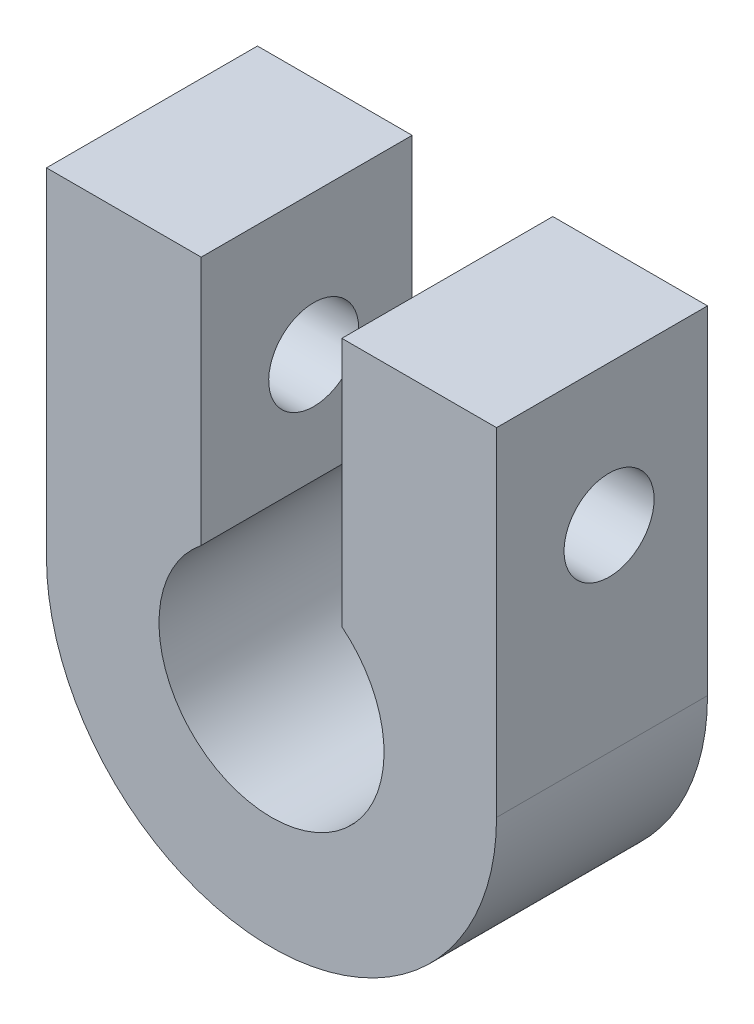
from build123d import *

# Parameters (mm, degrees)
BOSS_EXTRUDE1_DEPTH = 8
CUT_EXTRUDE1_DEPTH  = 17.492422502
CUT_EXTRUDE2_DEPTH  = 1.99
CUT_EXTRUDE4_REACH  = 23.541
SKETCH6_W           = 4
SKETCH6_H           = 8
SKETCH7_R           = 1.6
CUT_EXTRUDE5_DEPTH  = 22.540659229
CHAMFER1_SIZE       = 0.5


with BuildPart() as part:
    # Sketch1 → Boss-Extrude1 (new body)
    with BuildSketch(Plane.XY.offset(8)):
        with BuildLine():
            Line((8, 0), (8, 12))
            Line((8, 12), (-8, 12))
            Line((-8, 12), (-8, 0))
            ThreePointArc((-8, 0), (0, -8), (8, 0))
        make_face()
    extrude(amount=-BOSS_EXTRUDE1_DEPTH)

    # Sketch2 → Cut-Extrude1 (cut, through all)
    with BuildSketch(Plane(origin=(0, 0, 0), x_dir=(-1, 0, 0), z_dir=(0, 0, -1))):
        with BuildLine():
            Line((2.5, 12), (-2.5, 12))
            Line((-2.5, 12), (-2.5, 3.122498999))
            ThreePointArc((-2.5, 3.122498999), (0, 4), (2.5, 3.122498999))
            Line((2.5, 3.122498999), (2.5, 12))
        make_face()
    extrude(amount=-CUT_EXTRUDE1_DEPTH, mode=Mode.SUBTRACT)

    # Sketch3 → Cut-Extrude2 (cut)
    with BuildSketch(Plane.ZY.offset(8)):
        Polygon((5.674315, 4.100001352), (7.34863, 7), (5.674315, 9.899998648), (2.325685, 9.899998648), (0.65137, 7), (2.325685, 4.100001352), align=None)
    extrude(amount=-CUT_EXTRUDE2_DEPTH, mode=Mode.SUBTRACT)

    # Sketch5 → Cut-Extrude4 (cut, up to next)
    with BuildSketch(Plane(origin=(8, 0, 0), x_dir=(0, 0, -1), z_dir=(1, 0, 0)), mode=Mode.PRIVATE) as cut_extrude4_sk1:
        Polygon((-5.33035138, 6.111087627), (-5.13137085, 5.86862915), (-4.888912373, 5.66964862), (-4.612293492, 5.521792748), (-4.312144515, 5.430743551), (-4, 5.4), (-3.687855485, 5.430743551), (-3.387706508, 5.521792748), (-3.111087627, 5.66964862), (-2.86862915, 5.86862915), (-2.66964862, 6.111087627), (-2.521792748, 6.387706508), (-2.430743551, 6.687855485), (-2.4, 7), (-2.430743551, 7.312144515), (-2.521792748, 7.612293492), (-2.66964862, 7.888912373), (-2.86862915, 8.13137085), (-3.111087627, 8.33035138), (-3.387706508, 8.478207252), (-3.687855485, 8.569256449), (-4, 8.6), (-4.312144515, 8.569256449), (-4.612293492, 8.478207252), (-4.888912373, 8.33035138), (-5.13137085, 8.13137085), (-5.33035138, 7.888912373), (-5.478207252, 7.612293492), (-5.569256449, 7.312144515), (-5.6, 7), (-5.569256449, 6.687855485), (-5.478207252, 6.387706508), align=None)
    cut_extrude4_tool1 = extrude(cut_extrude4_sk1.sketch, amount=-CUT_EXTRUDE4_REACH, mode=Mode.PRIVATE) & part.part
    add(cut_extrude4_tool1.solids().sort_by_distance((8, 7, 4))[0], mode=Mode.SUBTRACT)

    # Sketch6 → Cut-Revolve1 (revolve, cut)
    with BuildSketch(Plane(origin=(0, 0, 0), x_dir=(1, 0, 0), z_dir=(0, 1, 0))):
        with Locations((2, -4)):
            Rectangle(SKETCH6_W, SKETCH6_H)
    revolve(axis=Axis((0, 0, 0), (0, 0, 1)), mode=Mode.SUBTRACT)

    # Sketch7 → Cut-Extrude5 (cut, through all)
    with BuildSketch(Plane(origin=(8, 0, 0), x_dir=(0, 0, -1), z_dir=(1, 0, 0))):
        with Locations(Location((-4, 7, 0), (0, 0, 270))):
            Circle(SKETCH7_R)
    extrude(amount=-CUT_EXTRUDE5_DEPTH, mode=Mode.SUBTRACT)

    # Chamfer1
    chamfer1_edges = [part.edges().sort_by_distance(p)[0] for p in [
        (5.25, 12, 0),
        (-8, 6, 0),
        (0, -4, 0),
        (-5.25, 12, 0),
        (-2.5, 7.5612495, 0),
        (2.5, 7.5612495, 0),
        (0, -8, 0),
        (8, 6, 0),
    ]]
    chamfer(chamfer1_edges, length=CHAMFER1_SIZE)


solid = part.part
